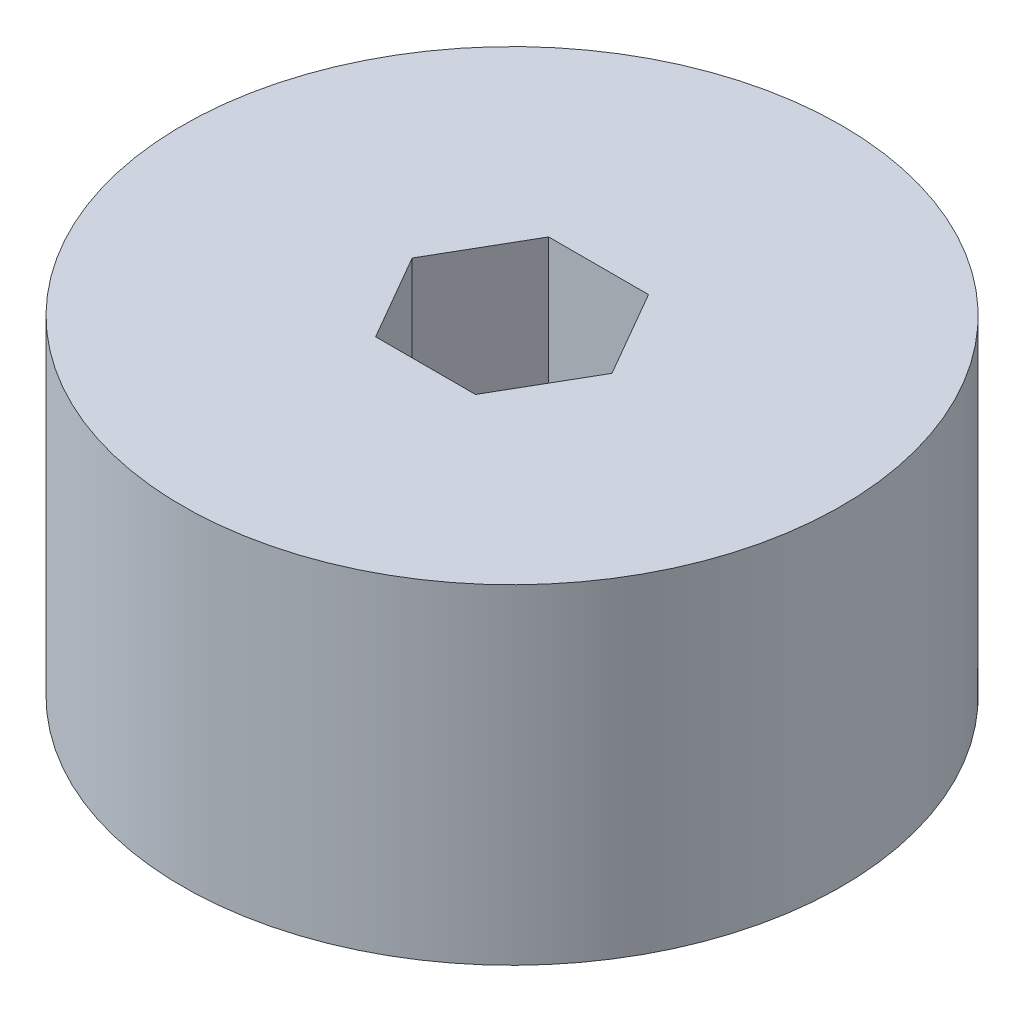
from build123d import *

# Parameters (mm, degrees)
SKETCH1_R           = 4.7625
BOSS_EXTRUDE1_DEPTH = 4.7625
CUT_EXTRUDE1_DEPTH  = 9.248891971


with BuildPart() as part:
    # Sketch1 → Boss-Extrude1 (new body)
    with BuildSketch(Plane(origin=(0, 0, 0), x_dir=(1, 0, 0), z_dir=(0, 1, 0))):
        with Locations(Location((0, 0, 0), (0, 0, 90))):
            Circle(SKETCH1_R)
    extrude(amount=BOSS_EXTRUDE1_DEPTH)

    # Sketch2 → Cut-Extrude1 (cut, through all)
    with BuildSketch(Plane.XZ):
        Polygon((0.721687836, 1.25), (-0.721687836, 1.25), (-1.443375673, 0), (-0.721687836, -1.25), (0.721687836, -1.25), (1.443375673, 0), align=None)
    extrude(amount=-CUT_EXTRUDE1_DEPTH, mode=Mode.SUBTRACT)


solid = part.part
